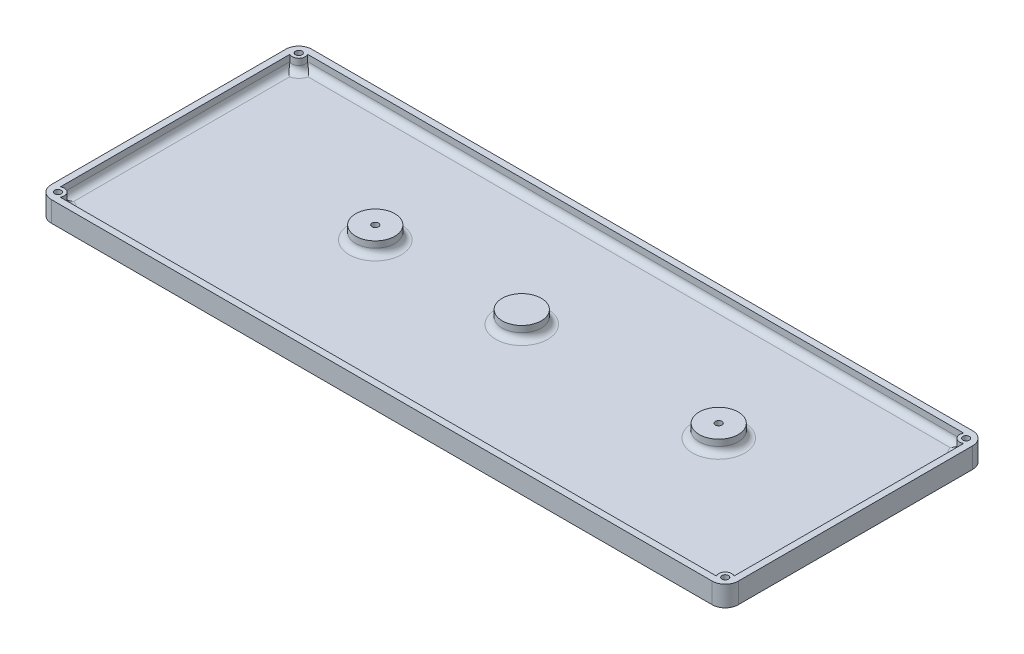
from build123d import *

# Parameters (mm, degrees)
BOSS_EXTRUDE1_DEPTH = 3
BOSS_EXTRUDE2_DEPTH = 5
SKETCH3_R           = 7.62
SKETCH3_R_2         = 1.27
SKETCH3_R_3         = 2.54
BOSS_EXTRUDE3_DEPTH = 5
FILLET1_R           = 2.54
SKETCH4_R           = 3
CUT_EXTRUDE1_DEPTH  = 4
FILLET2_R           = 0.635
CUT_EXTRUDE2_START  = -5
SKETCH5_R           = 1.27
CUT_EXTRUDE2_DEPTH  = 5


with BuildPart() as part:
    # Sketch1 → Boss-Extrude1 (new body)
    with BuildSketch(Plane(origin=(0, 0, 0), x_dir=(1, 0, 0), z_dir=(0, 1, 0))):
        with BuildLine():
            Line((-128.905, 50.8), (128.905, 50.8))
            ThreePointArc((128.905, 50.8), (132.497102448, 49.312102448), (133.985, 45.72))
            Line((133.985, 45.72), (133.985, -45.72))
            ThreePointArc((133.985, -45.72), (132.497102448, -49.312102448), (128.905, -50.8))
            Line((128.905, -50.8), (-128.905, -50.8))
            ThreePointArc((-128.905, -50.8), (-132.497102448, -49.312102448), (-133.985, -45.72))
            Line((-133.985, -45.72), (-133.985, 45.72))
            ThreePointArc((-133.985, 45.72), (-132.497102448, 49.312102448), (-128.905, 50.8))
        make_face()
    extrude(amount=BOSS_EXTRUDE1_DEPTH)

    # Sketch2 → Boss-Extrude2 (add)
    with BuildSketch(Plane(origin=(0, 3, 0), x_dir=(1, 0, 0), z_dir=(0, 1, 0))):
        with BuildLine():
            Line((-128.905, -50.8), (128.905, -50.8))
            ThreePointArc((128.905, -50.8), (132.497102448, -49.312102448), (133.985, -45.72))
            Line((133.985, -45.72), (133.985, 45.72))
            ThreePointArc((133.985, 45.72), (132.497102448, 49.312102448), (128.905, 50.8))
            Line((128.905, 50.8), (-128.905, 50.8))
            ThreePointArc((-128.905, 50.8), (-132.497102448, 49.312102448), (-133.985, 45.72))
            Line((-133.985, 45.72), (-133.985, -45.72))
            ThreePointArc((-133.985, -45.72), (-132.497102448, -49.312102448), (-128.905, -50.8))
        make_face()
        with BuildLine():
            Line((-128.905, -48.26), (128.905, -48.26))
            ThreePointArc((128.905, -48.26), (130.701051224, -47.516051224), (131.445, -45.72))
            Line((131.445, -45.72), (131.445, 45.72))
            ThreePointArc((131.445, 45.72), (130.701051224, 47.516051224), (128.905, 48.26))
            Line((128.905, 48.26), (-128.905, 48.26))
            ThreePointArc((-128.905, 48.26), (-130.701051224, 47.516051224), (-131.445, 45.72))
            Line((-131.445, 45.72), (-131.445, -45.72))
            ThreePointArc((-131.445, -45.72), (-130.701051224, -47.516051224), (-128.905, -48.26))
        make_face(mode=Mode.SUBTRACT)
    extrude(amount=BOSS_EXTRUDE2_DEPTH)

    # Sketch3 → Boss-Extrude3 (add)
    # profile 1 of 7: a face of its own
    with BuildSketch(Plane(origin=(0, 3, 0), x_dir=(1, 0, 0), z_dir=(0, 1, 0))):
        with Locations(Location((-57.15, 3.81, 0), (0, 0, 270))):
            Circle(SKETCH3_R)
        with Locations(Location((-57.15, 3.81, 0), (0, 0, 270))):
            Circle(SKETCH3_R_2, mode=Mode.SUBTRACT)
    # profile 2 of 7: a face of its own
    with BuildSketch(Plane(origin=(0, 3, 0), x_dir=(1, 0, 0), z_dir=(0, 1, 0))):
        with Locations(Location((0, 3.81, 0), (0, 0, 270))):
            Circle(SKETCH3_R)
    # profile 3 of 7: a face of its own
    with BuildSketch(Plane(origin=(0, 3, 0), x_dir=(1, 0, 0), z_dir=(0, 1, 0))):
        with Locations(Location((76.835, 3.81, 0), (0, 0, 270))):
            Circle(SKETCH3_R)
        with Locations(Location((76.835, 3.81, 0), (0, 0, 270))):
            Circle(SKETCH3_R_2, mode=Mode.SUBTRACT)
    # profile 4 of 7: a face of its own
    with BuildSketch(Plane(origin=(0, 3, 0), x_dir=(1, 0, 0), z_dir=(0, 1, 0))):
        with Locations((130.175, 46.99)):
            Circle(SKETCH3_R_3)
        with Locations((130.175, 46.99)):
            Circle(SKETCH3_R_2, mode=Mode.SUBTRACT)
    # profile 5 of 7: a face of its own
    with BuildSketch(Plane(origin=(0, 3, 0), x_dir=(1, 0, 0), z_dir=(0, 1, 0))):
        with Locations((-130.175, 46.99)):
            Circle(SKETCH3_R_3)
        with Locations((-130.175, 46.99)):
            Circle(SKETCH3_R_2, mode=Mode.SUBTRACT)
    # profile 6 of 7: a face of its own
    with BuildSketch(Plane(origin=(0, 3, 0), x_dir=(1, 0, 0), z_dir=(0, 1, 0))):
        with Locations((-130.175, -46.99)):
            Circle(SKETCH3_R_3)
        with Locations((-130.175, -46.99)):
            Circle(SKETCH3_R_2, mode=Mode.SUBTRACT)
    # profile 7 of 7: a face of its own
    with BuildSketch(Plane(origin=(0, 3, 0), x_dir=(1, 0, 0), z_dir=(0, 1, 0))):
        with Locations((130.175, -46.99)):
            Circle(SKETCH3_R_3)
        with Locations((130.175, -46.99)):
            Circle(SKETCH3_R_2, mode=Mode.SUBTRACT)
    extrude(amount=BOSS_EXTRUDE3_DEPTH)

    # Fillet1
    fillet1_edges = [part.edges().sort_by_distance(p)[0] for p in [
        (-131.445, 3, 0),
        (-128.378948776, 3, -45.193948776),
        (0, 3, 48.26),
        (-128.378948776, 3, 45.193948776),
        (131.445, 3, 0),
        (128.378948776, 3, 45.193948776),
        (-57.15, 3, -11.43),
        (0, 3, -11.43),
        (76.835, 3, -11.43),
        (0, 3, -48.26),
        (128.378948776, 3, -45.193948776),
    ]]
    fillet(fillet1_edges, radius=FILLET1_R)

    # Sketch4 → Cut-Extrude1 (cut)
    with BuildSketch(Plane.XZ):
        with Locations(Location((-57.15, -3.81, 0), (0, 0, 270))):
            Circle(SKETCH4_R)
        with Locations(Location((76.835, -3.81, 0), (0, 0, 270))):
            Circle(SKETCH4_R)
    extrude(amount=-CUT_EXTRUDE1_DEPTH, mode=Mode.SUBTRACT)

    # Fillet2
    fillet2_edges = [part.edges().sort_by_distance(p)[0] for p in [
        (-57.15, 0, -0.81),
        (76.835, 0, -0.81),
    ]]
    fillet(fillet2_edges, radius=FILLET2_R)

    # Sketch5 → Cut-Extrude2 (cut)
    with BuildSketch(Plane(origin=(0, 8, 0), x_dir=(1, 0, 0), z_dir=(0, 1, 0)).offset(CUT_EXTRUDE2_START)):
        with Locations(Location((130.175, 46.99, 0), (0, 0, 270))):
            Circle(SKETCH5_R)
        with Locations(Location((130.175, -46.99, 0), (0, 0, 270))):
            Circle(SKETCH5_R)
        with Locations(Location((-130.175, -46.99, 0), (0, 0, 270))):
            Circle(SKETCH5_R)
        with Locations(Location((-130.175, 46.99, 0), (0, 0, 270))):
            Circle(SKETCH5_R)
    extrude(amount=CUT_EXTRUDE2_DEPTH, mode=Mode.SUBTRACT)


solid = part.part
